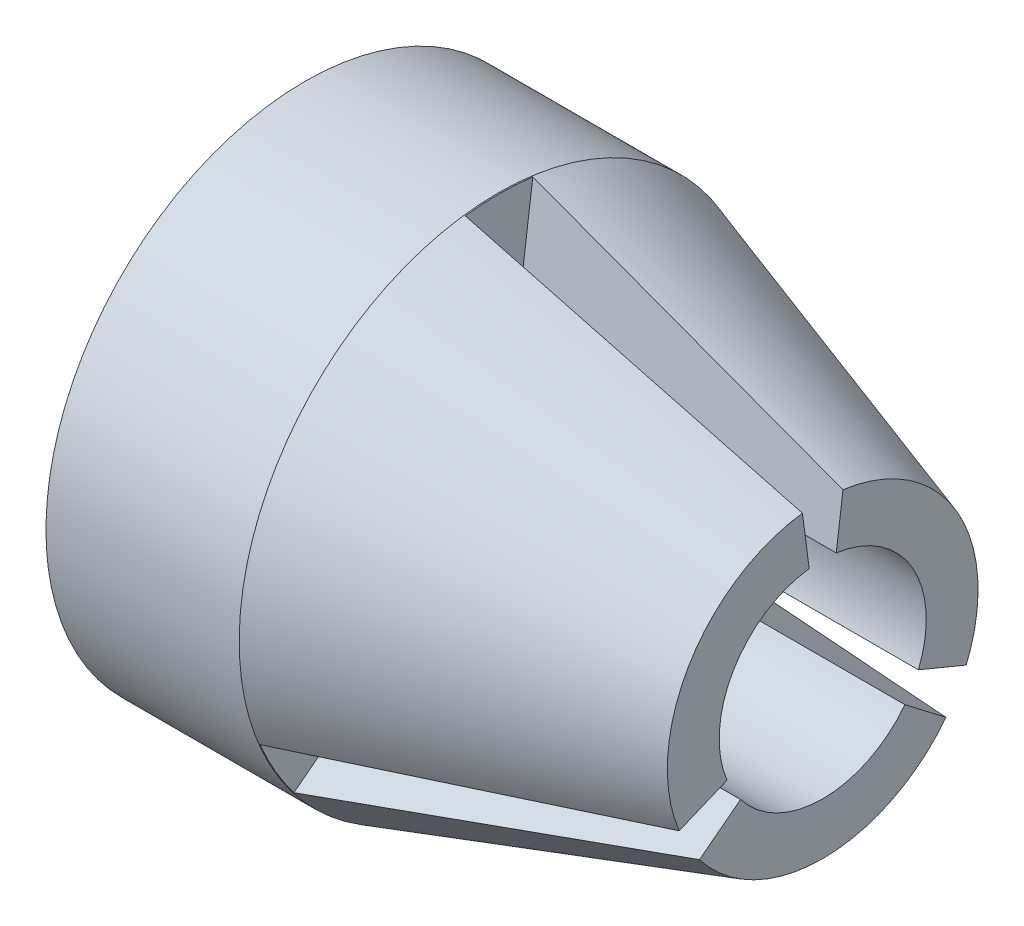
from build123d import *

# Parameters (mm, degrees)
SKETCH3_R          = 2
CUT_EXTRUDE1_DEPTH = 5
SKETCH4_R          = 1
CUT_EXTRUDE2_DEPTH = 5
CUT_EXTRUDE3_DEPTH = 6.25


with BuildPart() as part:
    # Sketch1 → Revolve1 (revolve)
    with BuildSketch(Plane.XY):
        Polygon((0, 0), (0, 5), (3.731538273, 5), (10, 3), (10, 0), align=None)
    revolve(axis=Axis((10, 0, 0), (-1, 0, 0)))

    # Sketch3 → Cut-Extrude1 (cut)
    with BuildSketch(Plane(origin=(10, 0, 0), x_dir=(0, 0, -1), z_dir=(1, 0, 0))):
        with Locations(Location((0, 0, 0), (0, 0, 90))):
            Circle(SKETCH3_R)
    extrude(amount=-CUT_EXTRUDE1_DEPTH, mode=Mode.SUBTRACT)

    # Sketch4 → Cut-Extrude2 (cut)
    with BuildSketch(Plane.ZY):
        with Locations(Location((0, 0, 0), (0, 0, 270))):
            Circle(SKETCH4_R)
    extrude(amount=-CUT_EXTRUDE2_DEPTH, mode=Mode.SUBTRACT)

    # Sketch5 → Cut-Extrude3 (cut)
    with BuildSketch(Plane(origin=(10, 0, 0), x_dir=(0, 0, -1), z_dir=(1, 0, 0))):
        with BuildLine():
            Line((-0.652630961, 4.957224307), (0, 0))
            Line((0, 0), (0.652630961, 4.957224307))
            ThreePointArc((0.652630961, 4.957224307), (0, 5), (-0.652630961, 4.957224307))
        make_face()
        with BuildLine():
            Line((4.619397663, -1.913417162), (0, 0))
            Line((0, 0), (3.966766701, -3.043807145))
            ThreePointArc((3.966766701, -3.043807145), (4.330127019, -2.5), (4.619397663, -1.913417162))
        make_face()
        with BuildLine():
            Line((-3.966766701, -3.043807145), (0, 0))
            Line((0, 0), (-4.619397663, -1.913417162))
            ThreePointArc((-4.619397663, -1.913417162), (-4.330127019, -2.5), (-3.966766701, -3.043807145))
        make_face()
    extrude(amount=-CUT_EXTRUDE3_DEPTH, mode=Mode.SUBTRACT)


solid = part.part
